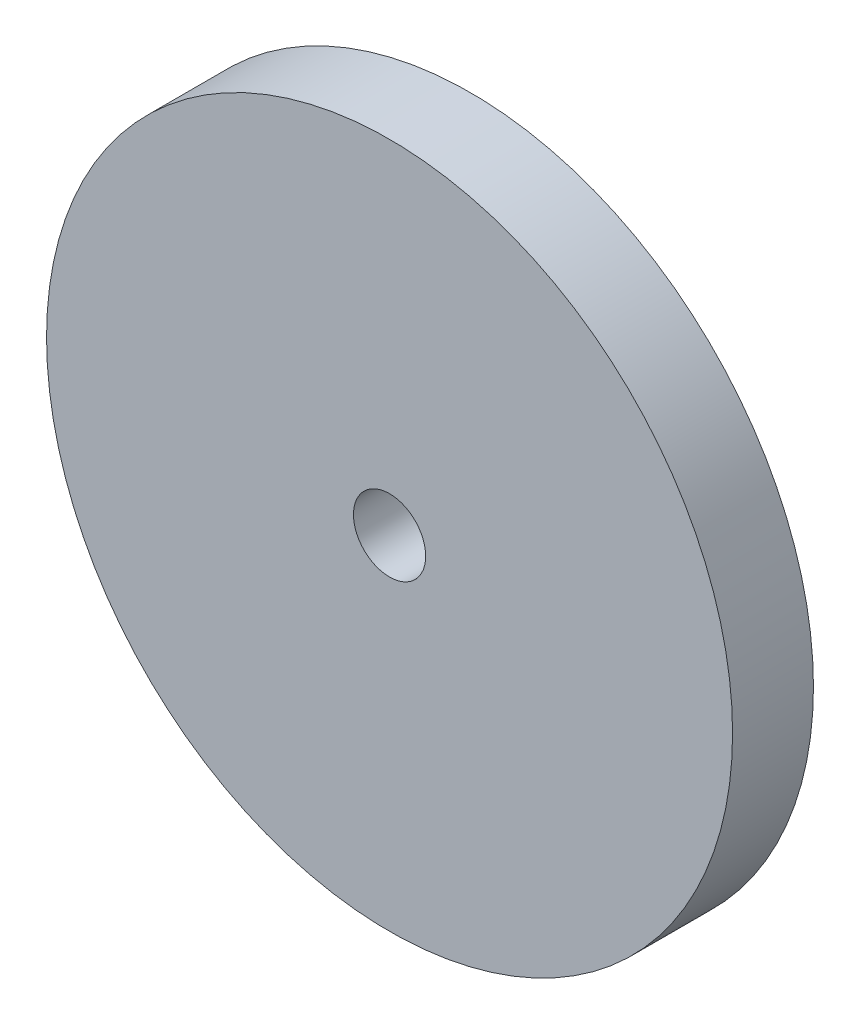
from build123d import *

# Parameters (mm, degrees)
SKETCH1_R                   = 30.1625
BOSS_EXTRUDE1_DEPTH         = 3.556
F_1_4_0_25_DIAMETER_HOLE1_D = 6.35


with BuildPart() as part:
    # Sketch1 → Boss-Extrude1 (new, symmetric)
    with BuildSketch(Plane.XY):
        Circle(SKETCH1_R)
    extrude(amount=BOSS_EXTRUDE1_DEPTH, both=True)

    # 1/4 (0.25) Diameter Hole1 (through all)
    with Locations(Plane.XY.offset(3.556)):
        with Locations((0, 0)):
            Hole(F_1_4_0_25_DIAMETER_HOLE1_D / 2)


solid = part.part
